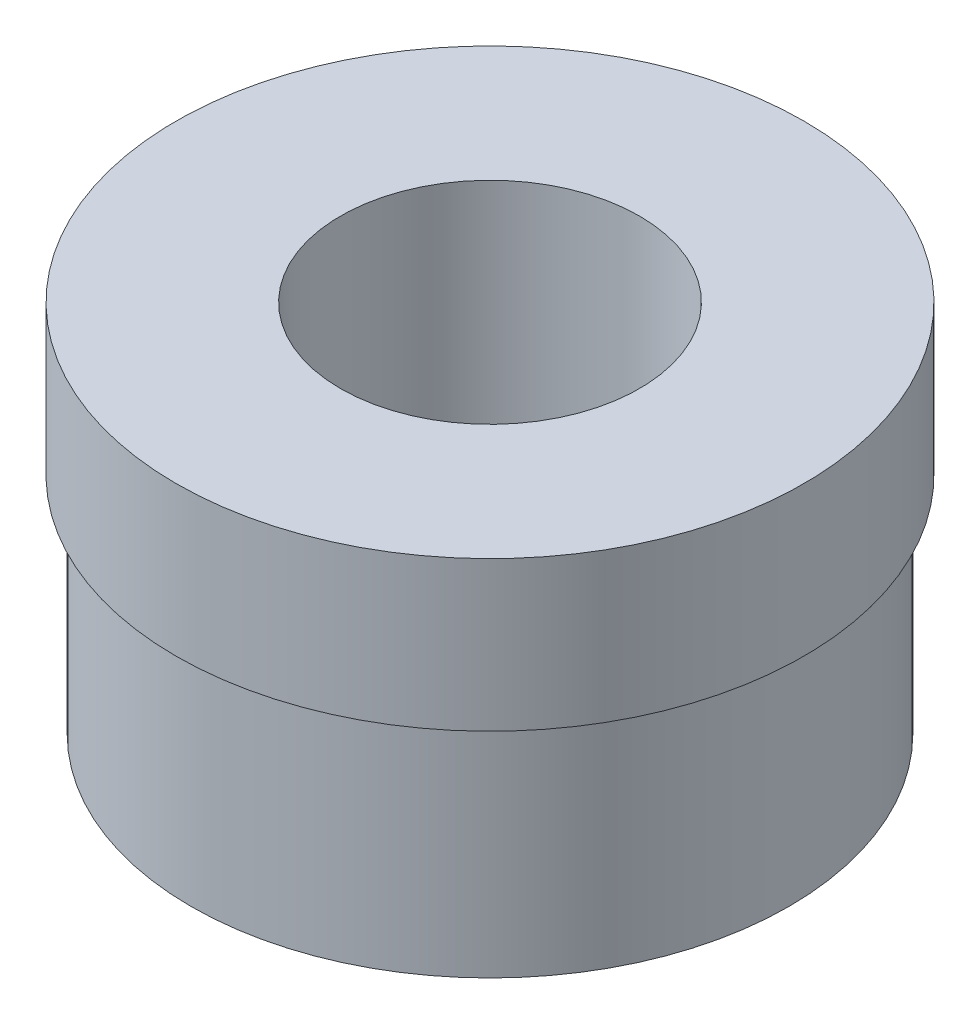
from build123d import *


with BuildPart() as part:
    # Sketch1 → Revolve1 (revolve)
    with BuildSketch(Plane.XY, mode=Mode.PRIVATE) as revolve1_sk:
        Polygon((10, 0), (10, 25), (21, 25), (21, 15), (20, 15), (20, 0), align=None)
    revolve(revolve1_sk.sketch.rotate(Axis((0, 61.834862385, 0), (0, -1, 0)), 90), axis=Axis((0, 61.834862385, 0), (0, -1, 0)))


solid = part.part
